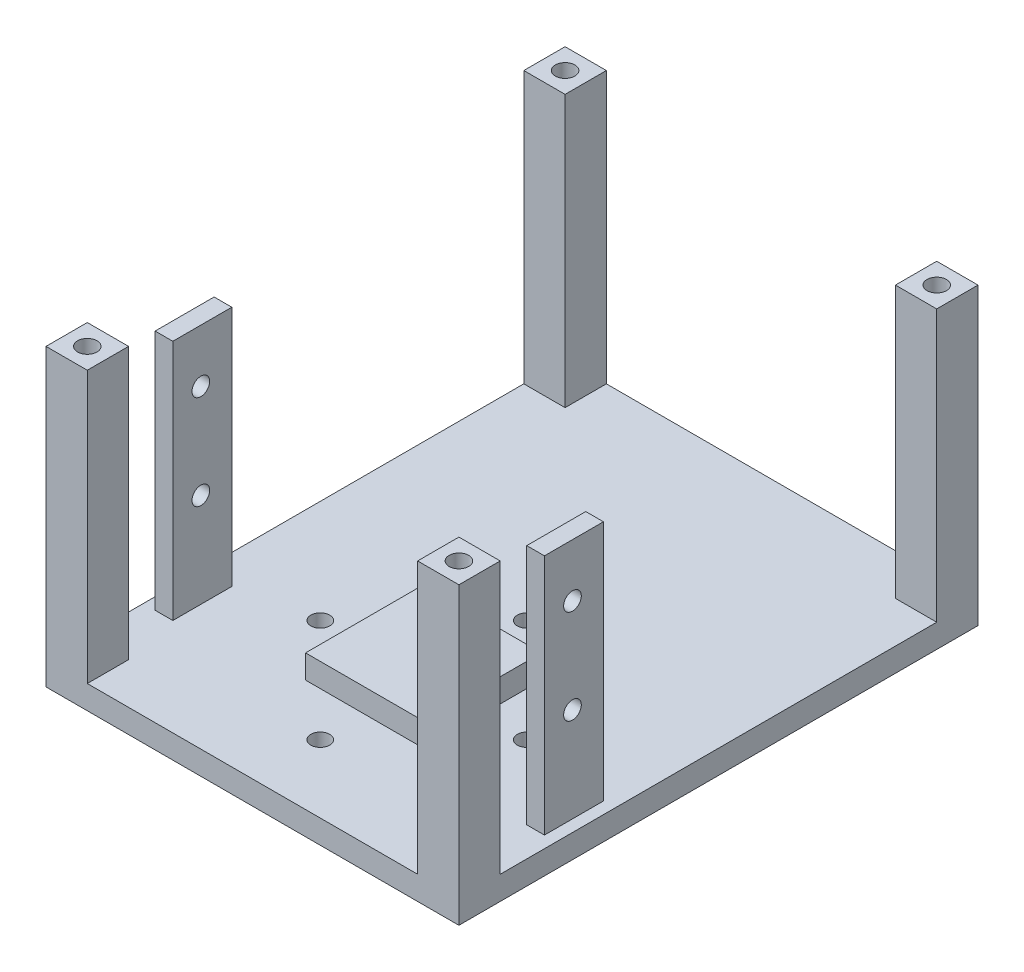
from build123d import *

# Parameters (mm, degrees)
SKETCH1_W           = 70
SKETCH1_H           = 88
BOSS_EXTRUDE1_DEPTH = 50
SKETCH2_R           = 1.65
CUT_EXTRUDE1_DEPTH  = 8
CUT_EXTRUDE2_DEPTH  = 46
SKETCH5_R           = 1.6
CUT_EXTRUDE4_DEPTH  = 73.642962495
SKETCH6_W           = 20
SKETCH6_H           = 20
BOSS_EXTRUDE2_DEPTH = 4
SKETCH7_W           = 3
SKETCH7_H           = 10
BOSS_EXTRUDE3_DEPTH = 41
SKETCH8_R           = 1.5
CUT_EXTRUDE5_DEPTH  = 10
CUT_EXTRUDE6_START  = -10
SKETCH9_R           = 1.5
CUT_EXTRUDE6_DEPTH  = 10


with BuildPart() as part:
    # Sketch1 → Boss-Extrude1 (new body)
    with BuildSketch(Plane(origin=(0, 0, 0), x_dir=(1, 0, 0), z_dir=(0, 1, 0))):
        Rectangle(SKETCH1_W, SKETCH1_H)
    extrude(amount=BOSS_EXTRUDE1_DEPTH)

    # Sketch2 → Cut-Extrude1 (cut)
    with BuildSketch(Plane(origin=(0, 50, 0), x_dir=(1, 0, 0), z_dir=(0, 1, 0))):
        with Locations(Location((-31.5, 40.5, 0), (0, 0, 270))):
            Circle(SKETCH2_R)
        with Locations(Location((31.5, 40.5, 0), (0, 0, 90))):
            Circle(SKETCH2_R)
        with Locations(Location((31.5, -40.5, 0), (0, 0, 270))):
            Circle(SKETCH2_R)
        with Locations(Location((-31.5, -40.5, 0), (0, 0, 90))):
            Circle(SKETCH2_R)
    extrude(amount=-CUT_EXTRUDE1_DEPTH, mode=Mode.SUBTRACT)

    # Sketch3 → Cut-Extrude2 (cut)
    with BuildSketch(Plane(origin=(0, 50, 0), x_dir=(1, 0, 0), z_dir=(0, 1, 0))):
        Polygon((-28, -44), (28, -44), (28, -37), (35, -37), (35, 37), (28, 37), (28, 44), (-28, 44), (-28, 37), (-35, 37), (-35, -37), (-28, -37), align=None)
    extrude(amount=-CUT_EXTRUDE2_DEPTH, mode=Mode.SUBTRACT)

    # Sketch5 → Cut-Extrude4 (cut, through all)
    with BuildSketch(Plane(origin=(0, 4, 0), x_dir=(1, 0, 0), z_dir=(0, 1, 0))):
        with Locations(Location((-17.5, -15, 0), (0, 0, 270))):
            Circle(SKETCH5_R)
        with Locations(Location((0, 2.5, 0), (0, 0, 270))):
            Circle(SKETCH5_R)
        with Locations(Location((0, -32.5, 0), (0, 0, 90))):
            Circle(SKETCH5_R)
        with Locations(Location((17.5, -15, 0), (0, 0, 90))):
            Circle(SKETCH5_R)
    extrude(amount=-CUT_EXTRUDE4_DEPTH, mode=Mode.SUBTRACT)

    # Sketch6 → Boss-Extrude2 (add)
    with BuildSketch(Plane(origin=(0, 4, 0), x_dir=(1, 0, 0), z_dir=(0, 1, 0))):
        with Locations((0, -15)):
            Rectangle(SKETCH6_W, SKETCH6_H)
    extrude(amount=BOSS_EXTRUDE2_DEPTH)

    # Sketch7 → Boss-Extrude3 (add)
    with BuildSketch(Plane(origin=(0, 4, 0), x_dir=(1, 0, 0), z_dir=(0, 1, 0))):
        with Locations((-31.5, -22.5)):
            Rectangle(SKETCH7_W, SKETCH7_H)
        with Locations((31.5, -22.5)):
            Rectangle(SKETCH7_W, SKETCH7_H)
    extrude(amount=BOSS_EXTRUDE3_DEPTH)

    # Sketch8 → Cut-Extrude5 (cut)
    with BuildSketch(Plane(origin=(-30, 0, 0), x_dir=(0, 0, -1), z_dir=(1, 0, 0))):
        with Locations((-22.75, 20)):
            Circle(SKETCH8_R)
        with Locations((-22.75, 36)):
            Circle(SKETCH8_R)
    extrude(amount=-CUT_EXTRUDE5_DEPTH, mode=Mode.SUBTRACT)

    # Sketch9 → Cut-Extrude6 (cut)
    with BuildSketch(Plane.ZY.offset(-30).offset(CUT_EXTRUDE6_START)):
        with Locations(Location((22.75, 20, 0), (0, 0, 180))):
            Circle(SKETCH9_R)
        with Locations(Location((22.75, 36, 0), (0, 0, 180))):
            Circle(SKETCH9_R)
    extrude(amount=CUT_EXTRUDE6_DEPTH, mode=Mode.SUBTRACT)


solid = part.part
